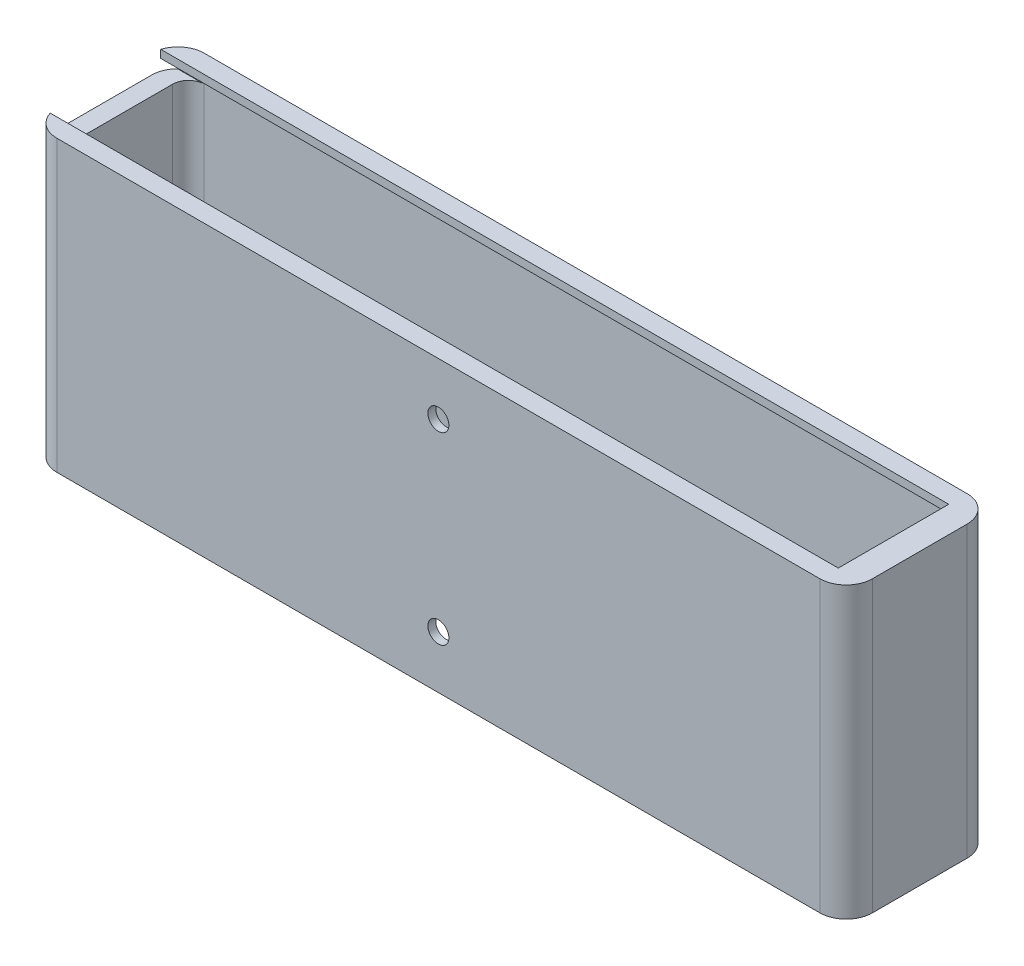
from build123d import *

# Parameters (mm, degrees)
ESBO_O1_W                = 155
ESBO_O1_H                = 55
RESSALTO_EXTRUS_O1_DEPTH = 28
ESBO_O3_W                = 148
ESBO_O3_H                = 25
CORTE_EXTRUS_O1_DEPTH    = 100.071943556
CORTE_EXTRUS_O2_REACH    = 161.891
RESSALTO_EXTRUS_O2_REACH = 158.501
ESBO_O6_W                = 2
ESBO_O6_H                = 1.5
RESSALTO_EXTRUS_O3_REACH = 158.501
ESBO_O7_W                = 2
ESBO_O7_H                = 1.5
ESBO_O9_W                = 21
ESBO_O9_H                = 1.5
RESSALTO_EXTRUS_O4_DEPTH = 1.5
FILETE1_R                = 5
FILETE2_R                = 3
RESSALTO_EXTRUS_O5_DEPTH = 1.5
CORTE_EXTRUS_O5_REACH    = 88.871
ESBO_O15_R               = 2


with BuildPart() as part:
    # Esboço1 → Ressalto-extrusão1 (new body)
    with BuildSketch(Plane.XY):
        Rectangle(ESBO_O1_W, ESBO_O1_H)
    extrude(amount=RESSALTO_EXTRUS_O1_DEPTH)

    # Esboço3 → Corte-extrusão1 (cut, through all)
    with BuildSketch(Plane.XZ.offset(27.5)):
        with Locations((0, 14)):
            Rectangle(ESBO_O3_W, ESBO_O3_H)
    extrude(amount=-CORTE_EXTRUS_O1_DEPTH, mode=Mode.SUBTRACT)

    # Esboço4 → Corte-extrusão2 (cut, up to next)
    with BuildSketch(Plane.ZY.offset(77.5), mode=Mode.PRIVATE) as corte_extrus_o2_sk1:
        Polygon((3.5, 27.5), (3.5, 26), (1.5, 26), (1.5, 23.9), (26.5, 23.9), (26.5, 26), (24.5, 26), (24.5, 27.5), align=None)
    corte_extrus_o2_tool1 = extrude(corte_extrus_o2_sk1.sketch, amount=-CORTE_EXTRUS_O2_REACH, mode=Mode.PRIVATE) & part.part
    add(corte_extrus_o2_tool1.solids().sort_by_distance((-77.5, 25.625, 14))[0], mode=Mode.SUBTRACT)

    # Esboço6 → Ressalto-extrusão2 (add, up to next)
    with BuildSketch(Plane(origin=(-74, 0, 0), x_dir=(0, 0, -1), z_dir=(1, 0, 0)), mode=Mode.PRIVATE) as ressalto_extrus_o2_sk1:
        with Locations((-2.5, 26.75)):
            Rectangle(ESBO_O6_W, ESBO_O6_H)
    ressalto_extrus_o2_tool1 = extrude(ressalto_extrus_o2_sk1.sketch, amount=RESSALTO_EXTRUS_O2_REACH, mode=Mode.PRIVATE) - part.part
    add(ressalto_extrus_o2_tool1.solids().sort_by_distance((-74, 26.75, 2.5))[0])

    # Esboço7 → Ressalto-extrusão3 (add, up to next)
    with BuildSketch(Plane(origin=(-74, 0, 0), x_dir=(0, 0, -1), z_dir=(1, 0, 0)), mode=Mode.PRIVATE) as ressalto_extrus_o3_sk1:
        with Locations((-25.5, 26.75)):
            Rectangle(ESBO_O7_W, ESBO_O7_H)
    ressalto_extrus_o3_tool1 = extrude(ressalto_extrus_o3_sk1.sketch, amount=RESSALTO_EXTRUS_O3_REACH, mode=Mode.PRIVATE) - part.part
    add(ressalto_extrus_o3_tool1.solids().sort_by_distance((-74, 26.75, 25.5))[0])

    # Esboço9 → Ressalto-extrusão4 (add)
    with BuildSketch(Plane.ZY.offset(-74)):
        with Locations((14, 26.75)):
            Rectangle(ESBO_O9_W, ESBO_O9_H)
    extrude(amount=RESSALTO_EXTRUS_O4_DEPTH)

    # Filete1
    filete1_edges = [part.edges().sort_by_distance(p)[0] for p in [
        (-77.5, 0, 28),
        (-77.5, 0, 0),
        (77.5, 0, 0),
        (77.5, 0, 28),
    ]]
    fillet(filete1_edges, radius=FILETE1_R)

    # Filete2
    filete2_edges = [part.edges().sort_by_distance(p)[0] for p in [
        (-74, -1.8, 26.5),
        (-74, -1.8, 1.5),
        (74, -0.75, 1.5),
        (74, -0.75, 26.5),
    ]]
    fillet(filete2_edges, radius=FILETE2_R)

    # Esboço12 → Ressalto-extrusão5 (add)
    with BuildSketch(Plane.XZ.offset(27.5)):
        Polygon((-21.304721722, 26.5), (-17.559412156, 26.5), (-27.546904334, 14), (-17.559412156, 1.5), (-21.304721722, 1.5), (-29.419559117, 11.65625), (-37.534396511, 1.5), (-41.279706078, 1.5), (-31.2922139, 14), (-41.279706078, 26.5), (-37.534396511, 26.5), (-29.419559117, 16.34375), align=None)
        Polygon((-71, 26.5), (-61.012507822, 14), (-71, 1.5), (-67.254690433, 1.5), (-59.139853039, 11.65625), (-51.025015645, 1.5), (-47.279706078, 1.5), (-57.267198256, 14), (-47.279706078, 26.5), (-51.025015645, 26.5), (-59.139853039, 16.34375), (-67.254690433, 26.5), align=None)
        Polygon((0.300734805, 16.34375), (-7.814102589, 26.5), (-11.559412156, 26.5), (-1.571919978, 14), (-11.559412156, 1.5), (-7.814102589, 1.5), (0.300734805, 11.65625), (8.4155722, 1.5), (12.160881766, 1.5), (2.173389589, 14), (12.160881766, 26.5), (8.4155722, 26.5), align=None)
        Polygon((30.021028727, 16.34375), (21.906191333, 26.5), (18.160881766, 26.5), (28.148373944, 14), (18.160881766, 1.5), (21.906191333, 1.5), (30.021028727, 11.65625), (38.135866122, 1.5), (41.881175688, 1.5), (31.893683511, 14), (41.881175688, 26.5), (38.135866122, 26.5), align=None)
        Polygon((59.741322649, 16.34375), (51.626485255, 26.5), (47.881175688, 26.5), (57.868667866, 14), (47.881175688, 1.5), (51.626485255, 1.5), (59.741322649, 11.65625), (67.856160044, 1.5), (71.60146961, 1.5), (61.613977433, 14), (71.60146961, 26.5), (67.856160044, 26.5), align=None)
    extrude(amount=-RESSALTO_EXTRUS_O5_DEPTH)

    # Esboço15 → Corte-extrusão5 (cut, up to next)
    with BuildSketch(Plane.XY.offset(28), mode=Mode.PRIVATE) as corte_extrus_o5_sk1:
        with Locations((0, 17.5)):
            Circle(ESBO_O15_R)
    corte_extrus_o5_tool1 = extrude(corte_extrus_o5_sk1.sketch, amount=-CORTE_EXTRUS_O5_REACH, mode=Mode.PRIVATE) & part.part
    # Esboço15 → Corte-extrusão5 (cut, up to next)
    with BuildSketch(Plane.XY.offset(28), mode=Mode.PRIVATE) as corte_extrus_o5_sk2:
        with Locations((0, -17.5)):
            Circle(ESBO_O15_R)
    corte_extrus_o5_tool2 = extrude(corte_extrus_o5_sk2.sketch, amount=-CORTE_EXTRUS_O5_REACH, mode=Mode.PRIVATE) & part.part
    add(corte_extrus_o5_tool1.solids().sort_by_distance((0, 17.5, 28))[0], mode=Mode.SUBTRACT)
    add(corte_extrus_o5_tool2.solids().sort_by_distance((0, -17.5, 28))[0], mode=Mode.SUBTRACT)


solid = part.part
